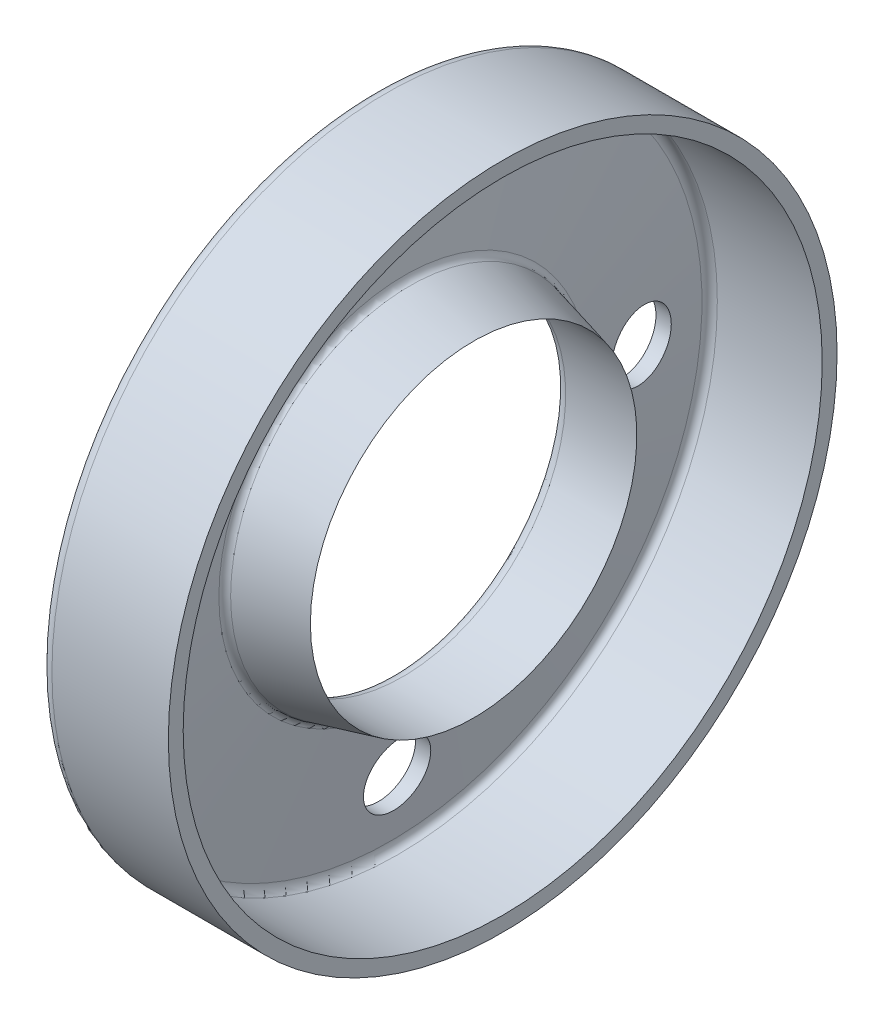
from build123d import *

# Parameters (mm, degrees)
SKETCH2_R          = 3.4925
CUT_EXTRUDE1_DEPTH = 52.167986429


with BuildPart() as part:
    # Sketch1 → Revolve1 (revolve)
    with BuildSketch(Plane.XY, mode=Mode.PRIVATE) as revolve1_sk:
        with BuildLine():
            Line((0.155348807, 33.477735982), (1.843834582, 18.161535982))
            ThreePointArc((1.843834582, 18.161535982), (2.258790389, 17.35475119), (3.106186901, 17.0307))
            Line((3.106186901, 17.0307), (10.5283, 17.0307))
            Line((10.5283, 17.0307), (3.88013628, 18.704834032))
            ThreePointArc((3.88013628, 18.704834032), (3.491808651, 18.943062367), (3.308801824, 19.360266859))
            Line((3.308801824, 19.360266859), (1.861135478, 32.492001589))
            ThreePointArc((1.861135478, 32.492001589), (2.050977583, 33.083937907), (2.618546869, 33.3375))
            Line((2.618546869, 33.3375), (13.5636, 33.3375))
            Line((13.5636, 33.3375), (13.5636, 34.8869))
            Line((13.5636, 34.8869), (1.417701126, 34.8869))
            ThreePointArc((1.417701126, 34.8869), (0.471752315, 34.464296512), (0.155348807, 33.477735982))
        make_face()
    revolve(revolve1_sk.sketch.rotate(Axis((-1000.538686221, 0, 0), (1, 0, 0)), 90), axis=Axis((-1000.538686221, 0, 0), (1, 0, 0)))

    # Sketch2 → Cut-Extrude1 (cut, through all)
    with BuildSketch(Plane(origin=(0, 0, 0), x_dir=(0, 0, -1), z_dir=(1, 0, 0))):
        with Locations(Location((0, -26.0604, 0), (0, 0, 315.343502334))):
            Circle(SKETCH2_R)
        with Locations(Location((0, 26.0604, 0), (0, 0, 315.324132172))):
            Circle(SKETCH2_R)
        with Locations(Location((25.4, 0, 0), (0, 0, 314.727093361))):
            Circle(SKETCH2_R)
    extrude(amount=CUT_EXTRUDE1_DEPTH, mode=Mode.SUBTRACT)


solid = part.part
